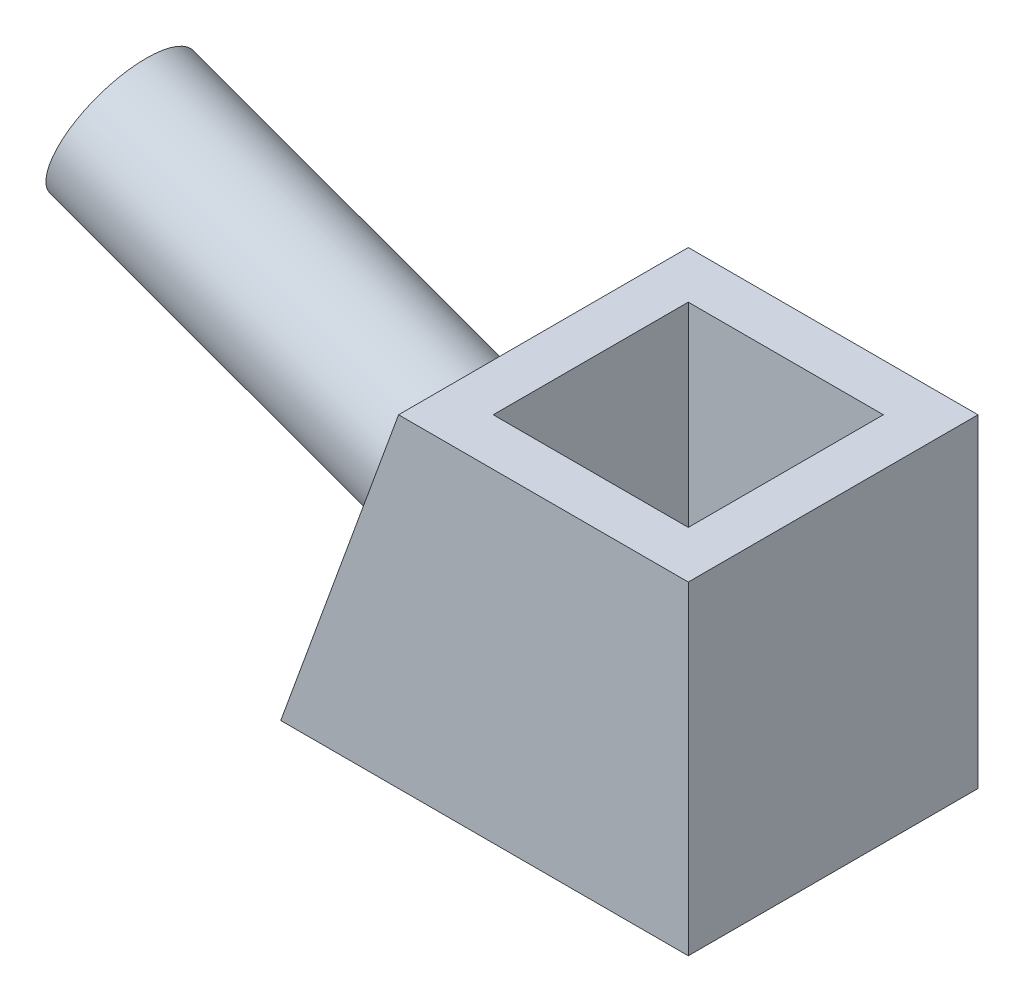
from build123d import *

# Parameters (mm, degrees)
SKETCH1_W           = 53.594
SKETCH1_H           = 38.1
BOSS_EXTRUDE1_DEPTH = 42.5694094
CUT_EXTRUDE1_DEPTH  = 79.333144024
SKETCH5_W           = 25.654
SKETCH5_H           = 25.654
CUT_EXTRUDE2_DEPTH  = 79.333144024
SKETCH6_R           = 9.4107
BOSS_EXTRUDE2_DEPTH = 50.8


with BuildPart() as part:
    # Sketch1 → Boss-Extrude1 (new body)
    with BuildSketch(Plane(origin=(0, 0, 0), x_dir=(1, 0, 0), z_dir=(0, 1, 0))):
        with Locations((26.797, 19.05)):
            Rectangle(SKETCH1_W, SKETCH1_H)
    extrude(amount=BOSS_EXTRUDE1_DEPTH)

    # Sketch4 → Cut-Extrude1 (cut, through all)
    with BuildSketch(Plane.XY):
        Polygon((0, -5.737e-06), (15.494, 42.5694094), (0, 42.5694094), align=None)
    extrude(amount=-CUT_EXTRUDE1_DEPTH, mode=Mode.SUBTRACT)

    # Sketch5 → Cut-Extrude2 (cut, through all)
    with BuildSketch(Plane(origin=(0, 42.5694094, 0), x_dir=(1, 0, 0), z_dir=(0, 1, 0))):
        with Locations((34.544, 19.05)):
            Rectangle(SKETCH5_W, SKETCH5_H)
    extrude(amount=-CUT_EXTRUDE2_DEPTH, mode=Mode.SUBTRACT)


with BuildPart() as boss_extrude2_tool:
    # Sketch6 → Boss-Extrude2 (new body)
    with BuildSketch(Plane(origin=(0, 0, 0), x_dir=(0, 0, 1), z_dir=(-0.9396926207859096, 0.3420201433256656, 0))):
        with Locations(Location((-19.05, 22.650709993, 0), (0, 0, 90))):
            Circle(SKETCH6_R)
    extrude(amount=BOSS_EXTRUDE2_DEPTH)


with BuildPart() as part_1:
    add(part.part)


with BuildPart() as part_2:
    # Boss-Extrude2: joined with boss_extrude2_tool
    add(part_1.part.fuse(boss_extrude2_tool.part, tol=0.00001))


solid = part_2.part
